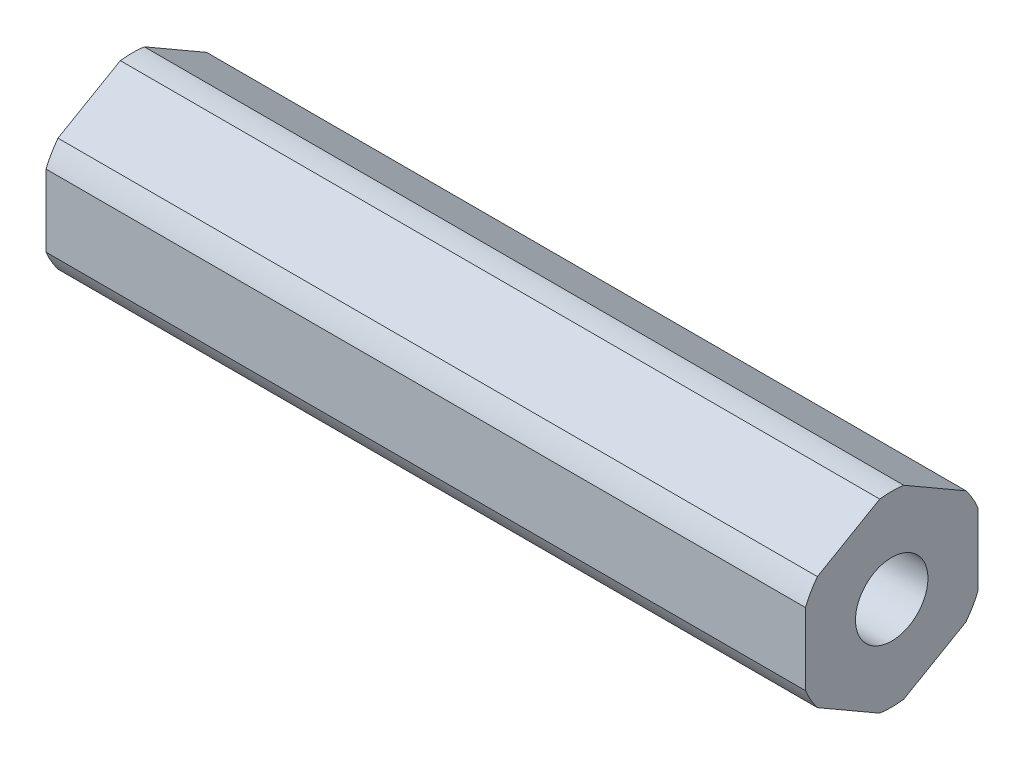
from build123d import *

# Parameters (mm, degrees)
SKETCH1_R           = 2.667
BOSS_EXTRUDE1_DEPTH = 55.88


with BuildPart() as part:
    # Sketch1 → Boss-Extrude1 (new body)
    with BuildSketch(Plane(origin=(-41.275, 0, 0), x_dir=(0, -1, 0), z_dir=(-1, 0, 0))):
        with BuildLine():
            Line((4.175261692, -5.468234615), (6.823260936, -0.881765385))
            ThreePointArc((6.823260936, -0.881765385), (6.88, 0), (6.823260936, 0.881765385))
            Line((6.823260936, 0.881765385), (4.175261692, 5.468234615))
            ThreePointArc((4.175261692, 5.468234615), (3.44, 5.958254778), (2.647999245, 6.35))
            Line((2.647999245, 6.35), (-2.647999245, 6.35))
            ThreePointArc((-2.647999245, 6.35), (-3.44, 5.958254778), (-4.175261692, 5.468234615))
            Line((-4.175261692, 5.468234615), (-6.823260936, 0.881765385))
            ThreePointArc((-6.823260936, 0.881765385), (-6.88, 0), (-6.823260936, -0.881765385))
            Line((-6.823260936, -0.881765385), (-4.175261692, -5.468234615))
            ThreePointArc((-4.175261692, -5.468234615), (-3.44, -5.958254778), (-2.647999245, -6.35))
            Line((-2.647999245, -6.35), (2.647999245, -6.35))
            ThreePointArc((2.647999245, -6.35), (3.44, -5.958254778), (4.175261692, -5.468234615))
        make_face()
        with Locations(Location((0, 0, 0), (0, 0, 270))):
            Circle(SKETCH1_R, mode=Mode.SUBTRACT)
    extrude(amount=-BOSS_EXTRUDE1_DEPTH)


solid = part.part
